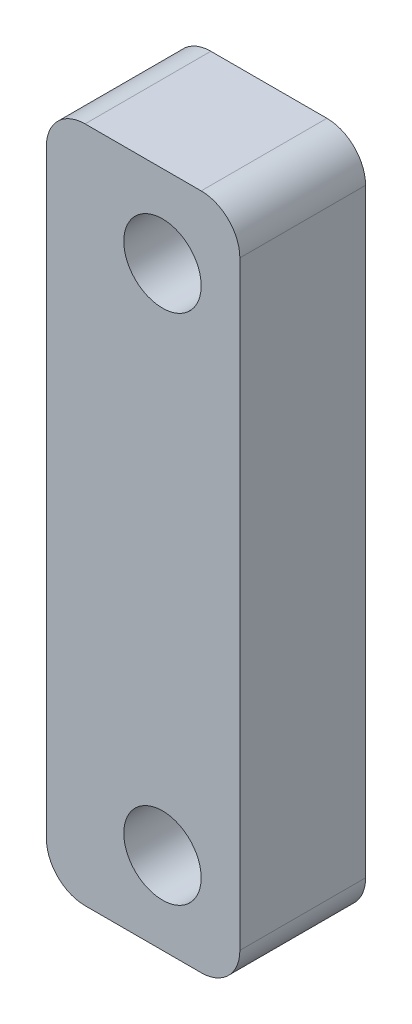
from build123d import *

# Parameters (mm, degrees)
ESBO_O2_R                = 2
RESSALTO_EXTRUS_O1_DEPTH = 4.5
RESSALTO_EXTRUS_O2_START = 2
RESSALTO_EXTRUS_O2_DEPTH = 2
ESBO_O4_R                = 2
CORTE_EXTRUS_O2_DEPTH    = 37.976343789


with BuildPart() as part:
    # Esboço2 → Ressalto-extrusão1 (new body)
    with BuildSketch(Plane.XY):
        with BuildLine():
            Line((0, 2), (0, 33))
            ThreePointArc((0, 33), (0.585786438, 34.414213562), (2, 35))
            Line((2, 35), (8, 35))
            ThreePointArc((8, 35), (9.414213562, 34.414213562), (10, 33))
            Line((10, 33), (10, 2))
            ThreePointArc((10, 2), (9.414213562, 0.585786438), (8, 0))
            Line((8, 0), (2, 0))
            ThreePointArc((2, 0), (0.585786438, 0.585786438), (0, 2))
        make_face()
        with Locations((6, 4.25)):
            Circle(ESBO_O2_R, mode=Mode.SUBTRACT)
        with Locations((6, 30.75)):
            Circle(ESBO_O2_R, mode=Mode.SUBTRACT)
    extrude(amount=RESSALTO_EXTRUS_O1_DEPTH)

    # Esboço3 → Ressalto-extrusão2 (add)
    with BuildSketch(Plane(origin=(0, 0, 0), x_dir=(-1, 0, 0), z_dir=(0, 0, -1)).offset(RESSALTO_EXTRUS_O2_START)):
        with BuildLine():
            Line((0, 2), (0, 33))
            ThreePointArc((0, 33), (-0.585786438, 34.414213562), (-2, 35))
            Line((-2, 35), (-8, 35))
            ThreePointArc((-8, 35), (-9.414213562, 34.414213562), (-10, 33))
            Line((-10, 33), (-10, 2))
            ThreePointArc((-10, 2), (-9.414213562, 0.585786438), (-8, 0))
            Line((-8, 0), (-2, 0))
            ThreePointArc((-2, 0), (-0.585786438, 0.585786438), (0, 2))
        make_face()
    extrude(amount=-RESSALTO_EXTRUS_O2_DEPTH)

    # Esboço4 → Corte-extrusão2 (cut, through all)
    with BuildSketch(Plane.XY.offset(4.5)):
        with Locations((6, 4.25)):
            Circle(ESBO_O4_R)
        with Locations((6, 30.75)):
            Circle(ESBO_O4_R)
    extrude(amount=-CORTE_EXTRUS_O2_DEPTH, mode=Mode.SUBTRACT)


solid = part.part
